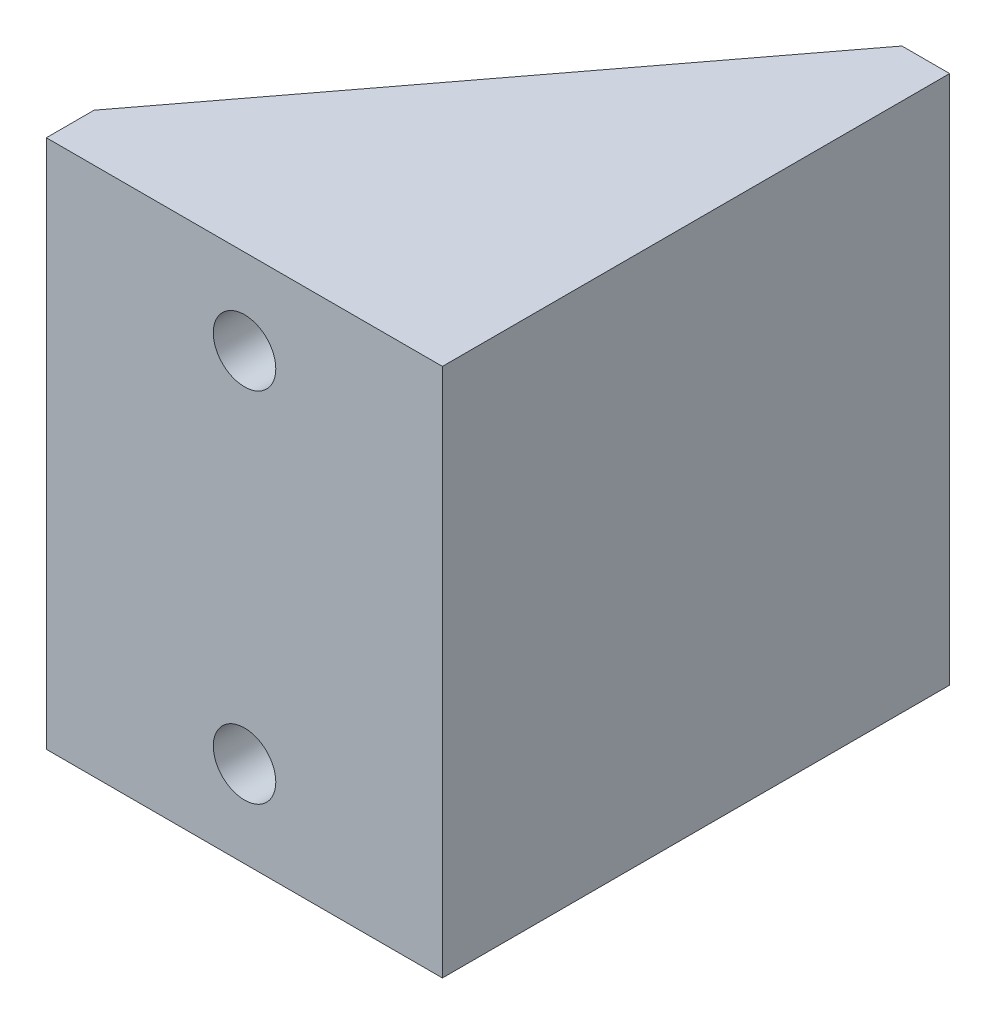
from build123d import *

# Parameters (mm, degrees)
SKETCH1_W           = 42.164
SKETCH1_H           = 56.388
BOSS_EXTRUDE1_DEPTH = 5.08
SKETCH2_W           = 54
SKETCH2_H           = 56.388
BOSS_EXTRUDE2_DEPTH = 5.08
SKETCH3_R           = 3.3274
CUT_EXTRUDE1_DEPTH  = 5.08
BOSS_EXTRUDE3_DEPTH = 5.08


with BuildPart() as part:
    # Sketch1 → Boss-Extrude1 (new body)
    with BuildSketch(Plane.XY):
        Rectangle(SKETCH1_W, SKETCH1_H)
    extrude(amount=BOSS_EXTRUDE1_DEPTH)

    # Sketch2 → Boss-Extrude2 (add)
    with BuildSketch(Plane(origin=(21.082, 0, 0), x_dir=(0, 0, -1), z_dir=(1, 0, 0))):
        with Locations((21.92, 0)):
            Rectangle(SKETCH2_W, SKETCH2_H)
    extrude(amount=-BOSS_EXTRUDE2_DEPTH)

    # Sketch3 → Cut-Extrude1 (cut)
    with BuildSketch(Plane.XY.offset(5.08)):
        with Locations((0.016403531, 19.102903585)):
            Circle(SKETCH3_R)
        with Locations((0.016403531, -18.997096415)):
            Circle(SKETCH3_R)
    extrude(amount=-CUT_EXTRUDE1_DEPTH, mode=Mode.SUBTRACT)

    # Sketch4 → Boss-Extrude3 (add)
    with BuildSketch(Plane(origin=(0, 28.194, 0), x_dir=(1, 0, 0), z_dir=(0, 1, 0))):
        Polygon((16.002, 48.92), (-21.082, 0), (16.002, 0), align=None)
    boss_extrude3 = extrude(amount=-BOSS_EXTRUDE3_DEPTH)

    # Mirror1: Boss-Extrude3 across plane
    add(boss_extrude3.mirror(Plane(origin=(0, 0, 0), x_dir=(0, 0, 1), z_dir=(0, -1, 0))))


solid = part.part
